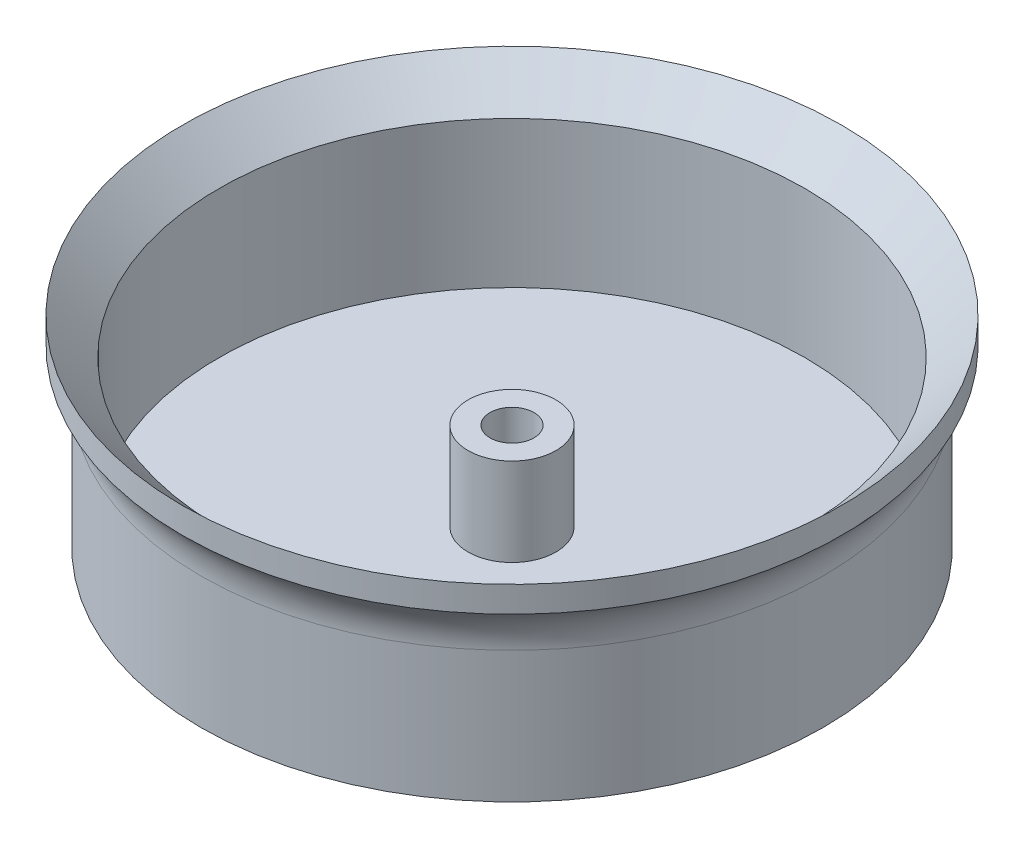
from build123d import *


with BuildPart() as part:
    # Sketch2 → Revolve1 (revolve)
    with BuildSketch(Plane(origin=(0, 0, 0), x_dir=(0, 0, -1), z_dir=(1, 0, 0)), mode=Mode.PRIVATE) as revolve1_sk:
        with BuildLine():
            Line((1.905, 0), (1.905, 9.2075))
            Line((1.905, 9.2075), (3.81, 9.2075))
            Line((3.81, 9.2075), (3.81, 1.5875))
            Line((3.81, 1.5875), (25.4, 1.5875))
            Line((25.4, 1.5875), (25.4, 14.2875))
            Line((25.4, 14.2875), (28.575, 17.4625))
            Line((28.575, 17.4625), (28.575, 15.21743597))
            ThreePointArc((28.575, 15.21743597), (27.400077808, 13.459040646), (26.9875, 11.384871939))
            Line((26.9875, 11.384871939), (26.9875, 0))
            Line((26.9875, 0), (1.905, 0))
        make_face()
    revolve(revolve1_sk.sketch.rotate(Axis((0, 0, 0), (0, -1, 0)), 180), axis=Axis((0, 0, 0), (0, -1, 0)))


solid = part.part
